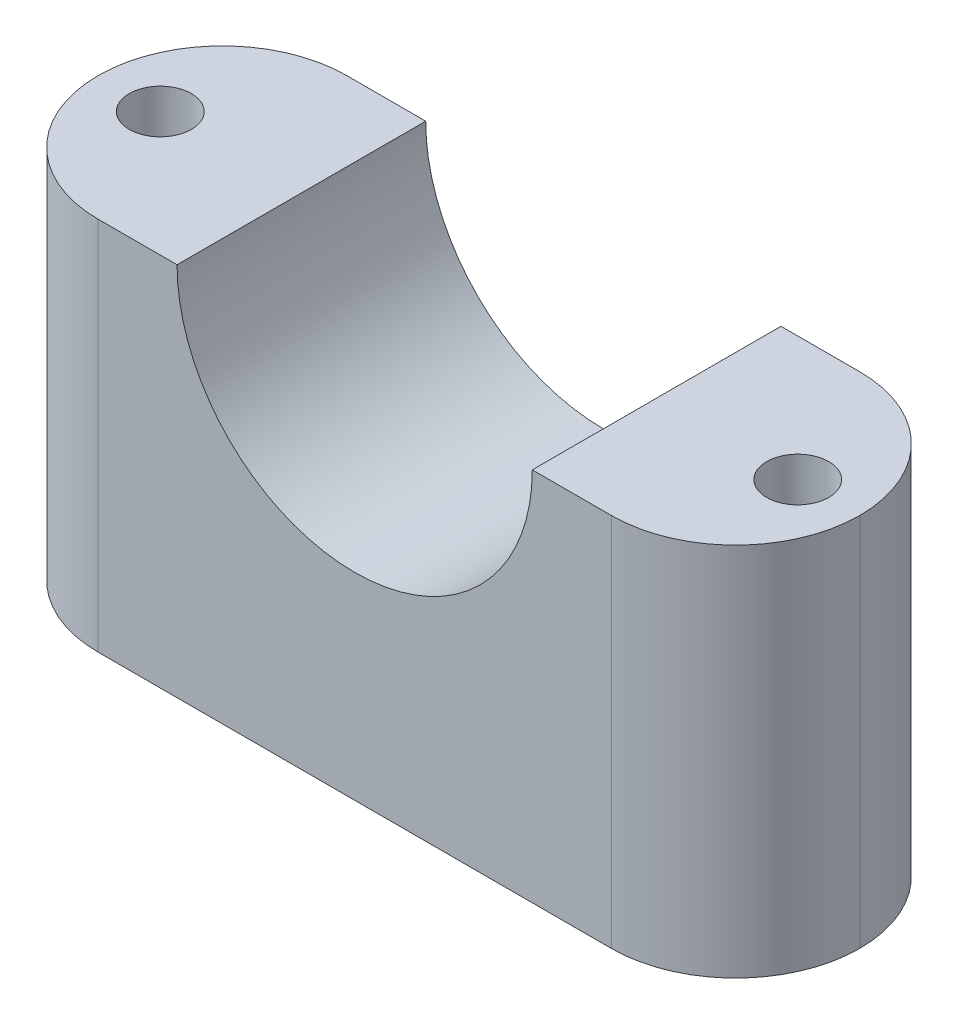
from build123d import *

# Parameters (mm, degrees)
SKETCH1_R           = 2
BOSS_EXTRUDE1_DEPTH = 24.13
SKETCH2_R           = 11.43
CUT_EXTRUDE1_DEPTH  = 57.932251879


with BuildPart() as part:
    # Sketch1 → Boss-Extrude1 (new body)
    with BuildSketch(Plane(origin=(0, 0, 0), x_dir=(1, 0, 0), z_dir=(0, 1, 0))):
        with BuildLine():
            Line((7.99846, 0), (41.02154, 0))
            ThreePointArc((41.02154, 0), (46.677305305, 2.342694695), (49.02, 7.99846))
            Line((49.02, 7.99846), (49.02, 8.00354))
            ThreePointArc((49.02, 8.00354), (46.677305305, 13.659305305), (41.02154, 16.002))
            Line((41.02154, 16.002), (7.99846, 16.002))
            ThreePointArc((7.99846, 16.002), (2.342694695, 13.659305305), (0, 8.00354))
            Line((0, 8.00354), (0, 7.99846))
            ThreePointArc((0, 7.99846), (2.342694695, 2.342694695), (7.99846, 0))
        make_face()
        with Locations(Location((4, 8.001, 0), (0, 0, 90))):
            Circle(SKETCH1_R, mode=Mode.SUBTRACT)
        with Locations(Location((45.02, 8.001, 0), (0, 0, 90))):
            Circle(SKETCH1_R, mode=Mode.SUBTRACT)
    extrude(amount=BOSS_EXTRUDE1_DEPTH)

    # Sketch2 → Cut-Extrude1 (cut, through all)
    with BuildSketch(Plane.XY):
        with Locations((24.51, 24.13)):
            Circle(SKETCH2_R)
    extrude(amount=-CUT_EXTRUDE1_DEPTH, mode=Mode.SUBTRACT)


solid = part.part
